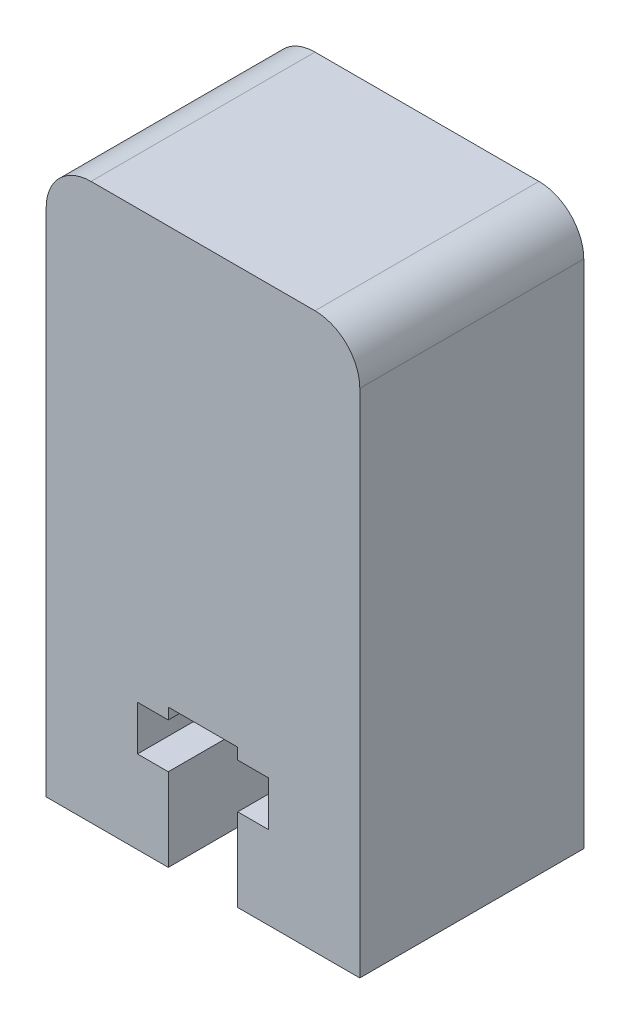
from build123d import *

# Parameters (mm, degrees)
DODANIE_WYCI_GNI_CIE1_DEPTH = 10
WYTNIJ_WYCI_GNI_CIE1_DEPTH  = 10


with BuildPart() as part:
    # Szkic1 → Dodanie-wyciągnięcie1 (new body)
    with BuildSketch(Plane.XY):
        with BuildLine():
            Line((-46.47600649, 4), (-60.47600649, 4))
            Line((-60.47600649, 4), (-60.47600649, 26.8))
            ThreePointArc((-60.47600649, 26.8), (-59.890220053, 28.214213562), (-58.47600649, 28.8))
            Line((-58.47600649, 28.8), (-48.47600649, 28.8))
            ThreePointArc((-48.47600649, 28.8), (-47.061792928, 28.214213562), (-46.47600649, 26.8))
            Line((-46.47600649, 26.8), (-46.47600649, 4))
        make_face()
    extrude(amount=DODANIE_WYCI_GNI_CIE1_DEPTH)

    # Szkic3 → Wytnij-wyciągnięcie1 (cut)
    with BuildSketch(Plane.XY.offset(10)):
        Polygon((-51.92600649, 4), (-55.02600649, 4), (-55.02600649, 7.7), (-56.40100649, 7.7), (-56.40100649, 9.7), (-55.02600649, 9.7), (-55.02600649, 10.2), (-51.92600649, 10.2), (-51.92600649, 9.7), (-50.55100649, 9.7), (-50.55100649, 7.7), (-51.92600649, 7.7), align=None)
    extrude(amount=-WYTNIJ_WYCI_GNI_CIE1_DEPTH, mode=Mode.SUBTRACT)


solid = part.part
